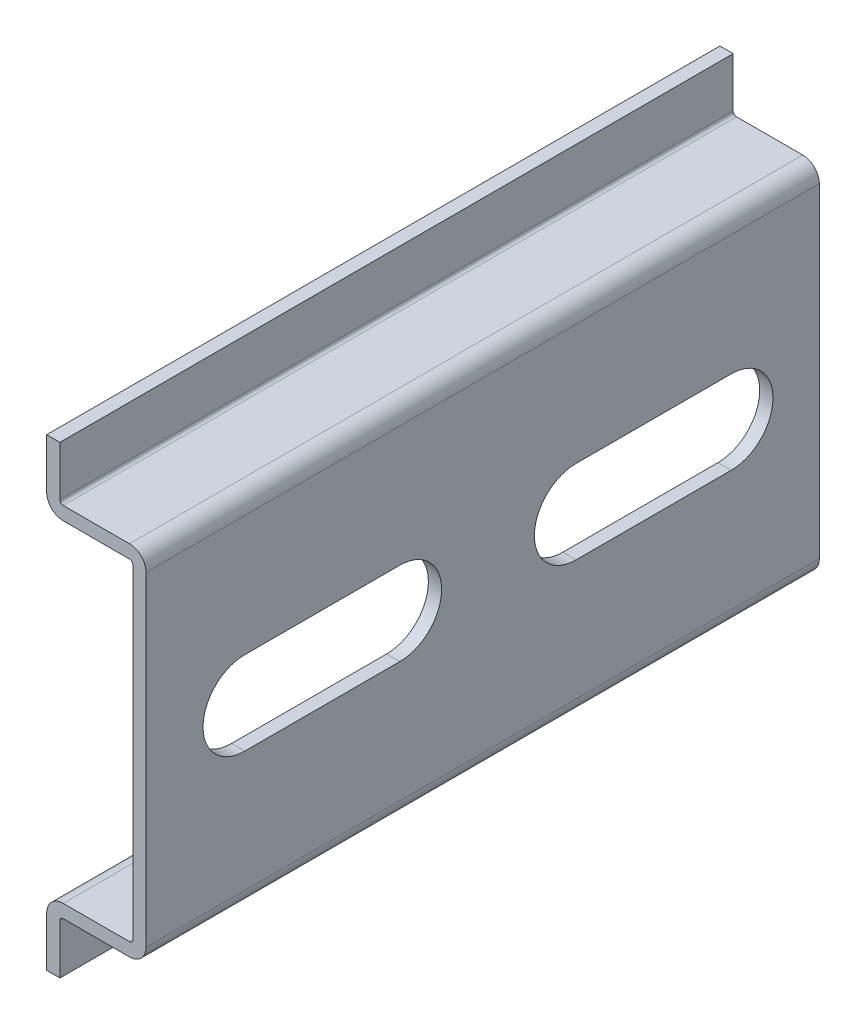
from build123d import *

# Parameters (mm, degrees)
EXTRUDE_THIN1_DEPTH = 50.8
CUT_EXTRUDE1_DEPTH  = 55.250714281
LPATTERN1_COUNT     = 2
LPATTERN1_PITCH     = 25
FILLET1_R           = 0.25
FILLET2_R           = 1.25


with BuildPart() as part:
    # Sketch3 → Extrude-Thin1 (new body)
    with BuildSketch(Plane.XY):
        Polygon((-6.5, 17.5), (-6.5, 13.5), (0, 13.5), (0, -13.5), (-6.5, -13.5), (-6.5, -17.5), (-7.5, -17.5), (-7.5, -12.5), (-1, -12.5), (-1, 12.5), (-7.5, 12.5), (-7.5, 17.5), align=None)
    extrude(amount=EXTRUDE_THIN1_DEPTH)

    # Sketch4 → Cut-Extrude1 (cut, symmetric)
    with BuildSketch(Plane(origin=(0, 0, 0), x_dir=(0, 0, -1), z_dir=(1, 0, 0))):
        with BuildLine():
            Line((-6.65, -3.15), (-18.35, -3.15))
            ThreePointArc((-18.35, -3.15), (-21.5, 0), (-18.35, 3.15))
            Line((-18.35, 3.15), (-6.65, 3.15))
            ThreePointArc((-6.65, 3.15), (-3.5, 0), (-6.65, -3.15))
        make_face()
    cut_extrude1 = extrude(amount=CUT_EXTRUDE1_DEPTH, both=True, mode=Mode.SUBTRACT)

    # LPattern1: Cut-Extrude1 ×2
    with Locations(*[(0, 0, i * LPATTERN1_PITCH) for i in range(1, LPATTERN1_COUNT)]):
        add(cut_extrude1, mode=Mode.SUBTRACT)

    # Fillet1
    fillet1_edges = [part.edges().sort_by_distance(p)[0] for p in [
        (-6.5, 13.5, 25.4),
        (-6.5, -13.5, 25.4),
        (-1, -12.5, 25.4),
        (-1, 12.5, 25.4),
    ]]
    fillet(fillet1_edges, radius=FILLET1_R)

    # Fillet2
    fillet2_edges = [part.edges().sort_by_distance(p)[0] for p in [
        (0, 13.5, 25.4),
        (0, -13.5, 25.4),
        (-7.5, -12.5, 25.4),
        (-7.5, 12.5, 25.4),
    ]]
    fillet(fillet2_edges, radius=FILLET2_R)


solid = part.part
